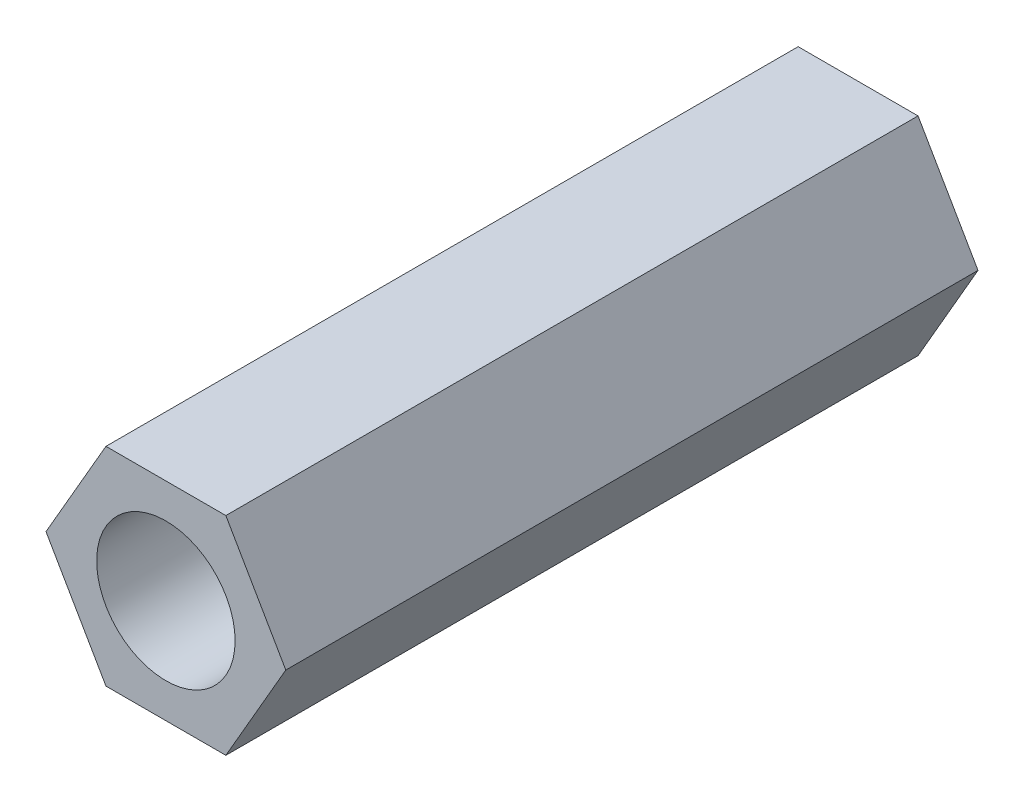
from build123d import *

# Parameters (mm, degrees)
SKETCH_1_R      = 1
EXTRUDE_1_DEPTH = 10


with BuildPart() as part:
    # 草图1 → 凸台-拉伸1 (new body)
    with BuildSketch(Plane.XY):
        Polygon((1.732050808, 0), (0.866025404, 1.5), (-0.866025404, 1.5), (-1.732050808, 0), (-0.866025404, -1.5), (0.866025404, -1.5), align=None)
        Circle(SKETCH_1_R, mode=Mode.SUBTRACT)
    extrude(amount=EXTRUDE_1_DEPTH)


solid = part.part
